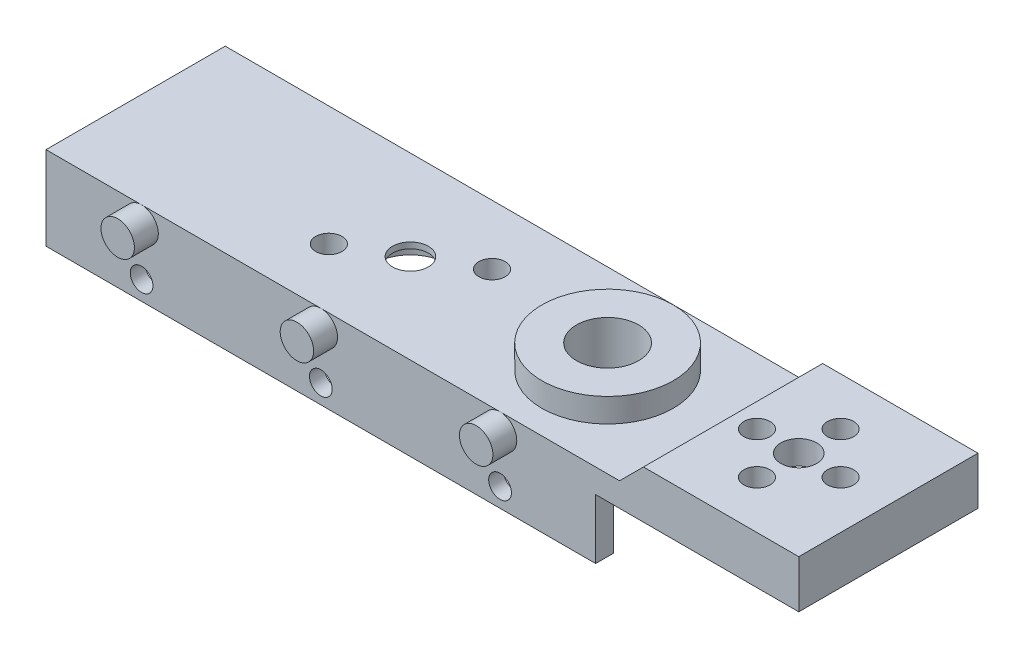
from build123d import *
from build123d.topology import SkipClean

# Parameters (mm, degrees)
SKETCH_1_W          = 63
SKETCH_1_H          = 15
SKETCH_1_R          = 1.5
SKETCH_1_R_2        = 1.1
SKETCH_1_R_3        = 2.6
EXTRUDE_1_DEPTH     = 2
SKETCH_2_R          = 1.4
EXTRUDE_2_DEPTH     = 2
SKETCH_3_R          = 3
CUT_EXTRUDE_1_DEPTH = 1.5
SKETCH_4_W          = 46
SKETCH_4_H          = 1.5
EXTRUDE_3_DEPTH     = 5
SKETCH_2_3_R        = 0.95
CUT_EXTRUDE_2_DEPTH = 1.5
CUT_EXTRUDE_3_DEPTH = 0.25
SKETCH_1_7_W        = 15
SKETCH_1_7_H        = 15
SKETCH_1_7_R        = 1.5
SKETCH_1_7_R_2      = 1.1
EXTRUDE_4_DEPTH     = 4
SKETCH_1_8_R        = 6
SKETCH_1_8_R_2      = 1.5
SKETCH_1_8_R_3      = 1.1
CUT_EXTRUDE_4_DEPTH = 2
CUT_EXTRUDE_5_DEPTH = 15
EXTRUDE_START       = 3
SKETCH_8_R          = 5.5
SKETCH_8_R_2        = 2.6
EXTRUDE_11_DEPTH    = 3
CUT_EXTRUDE_6_DEPTH = 3.5
CUT_EXTRUDE_7_DEPTH = 3
SKETCH_8_2_R        = 5.5
SKETCH_8_2_R_2      = 2.6
EXTRUDE_12_DEPTH    = 4


with BuildPart() as part:
    # 草图1 → 凸台-拉伸1 (new body)
    with BuildSketch(Plane(origin=(0, 0, 0), x_dir=(1, 0, 0), z_dir=(0, 1, 0))):
        Rectangle(SKETCH_1_W, SKETCH_1_H)
        with Locations(Location((-8.5, 0, 0), (0, 0, 270))):
            Circle(SKETCH_1_R, mode=Mode.SUBTRACT)
        with Locations(Location((-4.169872981, 2.5, 0), (0, 0, 270))):
            Circle(SKETCH_1_R_2, mode=Mode.SUBTRACT)
        with Locations(Location((-12.830127019, -2.5, 0), (0, 0, 270))):
            Circle(SKETCH_1_R_2, mode=Mode.SUBTRACT)
        with Locations(Location((8, 0, 0), (0, 0, 270))):
            Circle(SKETCH_1_R_3, mode=Mode.SUBTRACT)
        with Locations(Location((24, 0, 0), (0, 0, 270))):
            Circle(SKETCH_1_R, mode=Mode.SUBTRACT)
        with Locations(Location((27.5, 0, 0), (0, 0, 270))):
            Circle(SKETCH_1_R_2, mode=Mode.SUBTRACT)
        with Locations(Location((24, -3.5, 0), (0, 0, 270))):
            Circle(SKETCH_1_R_2, mode=Mode.SUBTRACT)
        with Locations(Location((20.5, 0, 0), (0, 0, 270))):
            Circle(SKETCH_1_R_2, mode=Mode.SUBTRACT)
        with Locations(Location((24, 3.5, 0), (0, 0, 270))):
            Circle(SKETCH_1_R_2, mode=Mode.SUBTRACT)
    extrude(amount=EXTRUDE_1_DEPTH)

    # 草图2 → 凸台-拉伸2 (add)
    with BuildSketch(Plane.XY.offset(7.5)):
        with Locations(Location((-23.5, 0.6, 0), (0, 0, 205.376933525))):
            Circle(SKETCH_2_R)
        with Locations(Location((-8.5, 0.6, 0), (0, 0, 205.376933525))):
            Circle(SKETCH_2_R)
        with Locations(Location((6.5, 0.6, 0), (0, 0, 205.376933525))):
            Circle(SKETCH_2_R)
    extrude(amount=EXTRUDE_2_DEPTH)

    # 草图3 → 切除-拉伸1 (cut)
    with BuildSketch(Plane.XZ):
        with Locations(Location((-8.5, 0, 0), (0, 0, 270))):
            Circle(SKETCH_3_R)
    extrude(amount=-CUT_EXTRUDE_1_DEPTH, mode=Mode.SUBTRACT)

    # 草图4 → 凸台-拉伸3 (add)
    with BuildSketch(Plane.XZ):
        with Locations((-8.5, 6.75)):
            Rectangle(SKETCH_4_W, SKETCH_4_H)
    extrude(amount=EXTRUDE_3_DEPTH)

    # 草图2<3> → 切除-拉伸2 (cut)
    with BuildSketch(Plane.XY.offset(7.5)):
        with Locations((-23.5, -3.4)):
            Circle(SKETCH_2_3_R)
        with Locations((-8.5, -3.4)):
            Circle(SKETCH_2_3_R)
        with Locations((6.5, -3.4)):
            Circle(SKETCH_2_3_R)
    extrude(amount=-CUT_EXTRUDE_2_DEPTH, mode=Mode.SUBTRACT)

    # 草图5 → 切除-拉伸3 (cut)
    with BuildSketch(Plane(origin=(0, 0, 6), x_dir=(-1, 0, 0), z_dir=(0, 0, -1))):
        Polygon((22.403034489, -1.5), (24.596965511, -1.5), (25.693931023, -3.4), (24.596965511, -5.3), (22.403034489, -5.3), (21.306068977, -3.4), align=None)
        Polygon((6.306068977, -3.4), (7.403034489, -1.5), (9.596965511, -1.5), (10.693931023, -3.4), (9.596965511, -5.3), (7.403034489, -5.3), align=None)
        Polygon((-8.693931023, -3.4), (-7.596965511, -1.5), (-5.403034489, -1.5), (-4.306068977, -3.4), (-5.403034489, -5.3), (-7.596965511, -5.3), align=None)
    extrude(amount=-CUT_EXTRUDE_3_DEPTH, mode=Mode.SUBTRACT)

    # 草图1<7> → 凸台-拉伸4 (add)
    with SkipClean():  # the faces are left unmerged after this step: merging them gives an invalid solid
        with BuildSketch(Plane(origin=(0, 0, 0), x_dir=(1, 0, 0), z_dir=(0, 1, 0))):
            with Locations((24, 0)):
                Rectangle(SKETCH_1_7_W, SKETCH_1_7_H)
            with Locations(Location((24, 0, 0), (0, 0, 270))):
                Circle(SKETCH_1_7_R, mode=Mode.SUBTRACT)
            with Locations(Location((27.5, 0, 0), (0, 0, 270))):
                Circle(SKETCH_1_7_R_2, mode=Mode.SUBTRACT)
            with Locations(Location((24, -3.5, 0), (0, 0, 270))):
                Circle(SKETCH_1_7_R_2, mode=Mode.SUBTRACT)
            with Locations(Location((20.5, 0, 0), (0, 0, 270))):
                Circle(SKETCH_1_7_R_2, mode=Mode.SUBTRACT)
            with Locations(Location((24, 3.5, 0), (0, 0, 270))):
                Circle(SKETCH_1_7_R_2, mode=Mode.SUBTRACT)
        extrude(amount=EXTRUDE_4_DEPTH)

    # 草图1<8> → 切除-拉伸4 (cut)
    with SkipClean():  # the faces are left unmerged after this step: merging them gives an invalid solid
        with BuildSketch(Plane(origin=(0, 0, 0), x_dir=(1, 0, 0), z_dir=(0, 1, 0))):
            with Locations(Location((24, 0, 0), (0, 0, 270))):
                Circle(SKETCH_1_8_R)
            with Locations(Location((24, 0, 0), (0, 0, 270))):
                Circle(SKETCH_1_8_R_2, mode=Mode.SUBTRACT)
            with Locations(Location((27.5, 0, 0), (0, 0, 270))):
                Circle(SKETCH_1_8_R_3, mode=Mode.SUBTRACT)
            with Locations(Location((24, -3.5, 0), (0, 0, 270))):
                Circle(SKETCH_1_8_R_3, mode=Mode.SUBTRACT)
            with Locations(Location((20.5, 0, 0), (0, 0, 270))):
                Circle(SKETCH_1_8_R_3, mode=Mode.SUBTRACT)
            with Locations(Location((24, 3.5, 0), (0, 0, 270))):
                Circle(SKETCH_1_8_R_3, mode=Mode.SUBTRACT)
        extrude(amount=CUT_EXTRUDE_4_DEPTH, mode=Mode.SUBTRACT)

    # 草图6 → 切除-拉伸5 (cut)
    with BuildSketch(Plane(origin=(0, 0, -7.5), x_dir=(-1, 0, 0), z_dir=(0, 0, -1))):
        Polygon((-16.5, 2), (-18.5, 4), (-16.5, 4), align=None)
    extrude(amount=-CUT_EXTRUDE_5_DEPTH, mode=Mode.SUBTRACT)

    # 草图8 → 凸台-拉伸11 (add)
    with SkipClean():  # the faces are left unmerged after this step: merging them gives an invalid solid
        with BuildSketch(Plane.XZ.offset(EXTRUDE_START)):
            with Locations(Location((8, 0, 0), (0, 0, 90))):
                Circle(SKETCH_8_R)
            with Locations(Location((8, 0, 0), (0, 0, 270))):
                Circle(SKETCH_8_R_2, mode=Mode.SUBTRACT)
        extrude(amount=-EXTRUDE_11_DEPTH)

    # 草图10 → 切除-拉伸6 (cut)
    with BuildSketch(Plane.XZ.offset(3)):
        Polygon((8, 3.175426481), (5.25, 1.58771324), (5.25, -1.58771324), (8, -3.175426481), (10.75, -1.58771324), (10.75, 1.58771324), align=None)
    extrude(amount=-CUT_EXTRUDE_6_DEPTH, mode=Mode.SUBTRACT)

    # 草图11 → 切除-拉伸7 (cut)
    with BuildSketch(Plane.XZ.offset(3)):
        with BuildLine():
            Line((3.101020514, 2.5), (12.898979486, 2.5))
            ThreePointArc((12.898979486, 2.5), (8, 5.5), (3.101020514, 2.5))
        make_face()
    extrude(amount=-CUT_EXTRUDE_7_DEPTH, mode=Mode.SUBTRACT)

    # 草图8<2> → 凸台-拉伸12 (add)
    with BuildSketch(Plane.XZ):
        with Locations(Location((8, 0, 0), (0, 0, 270))):
            Circle(SKETCH_8_2_R)
        with Locations(Location((8, 0, 0), (0, 0, 270))):
            Circle(SKETCH_8_2_R_2, mode=Mode.SUBTRACT)
    extrude(amount=-EXTRUDE_12_DEPTH)


solid = part.part
